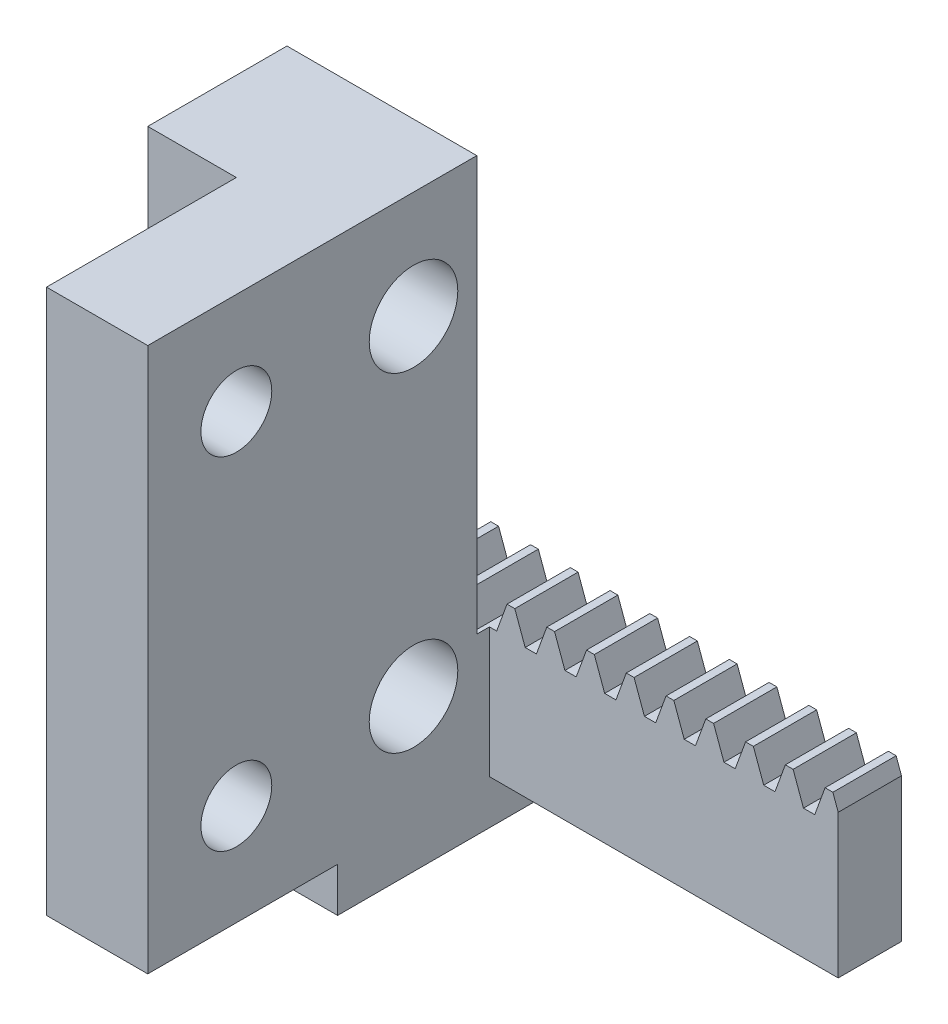
from build123d import *

# Parameters (mm, degrees)
BLANKSKE_W                 = 40
BLANKSKE_H                 = 12.5
BLANK_DEPTH                = 5
TOOTHCUTSIM_DEPTH          = 43.20485754
TEETHCUTS_COUNT            = 14
TEETHCUTS_PITCH            = 3.14159265
MOVE_FACE1_BY              = 0.44
SKETCH1_W                  = 15
SKETCH1_H                  = 43
BOSS_EXTRUDE1_DEPTH        = 12
F_7_0_7_DIAMETER_HOLE1_D   = 7
SKETCH6_W                  = 2.7
SKETCH6_H                  = 17
BOSS_EXTRUDE2_DEPTH        = 3.5
SKETCH7_W                  = 8
SKETCH7_H                  = 43
BOSS_EXTRUDE3_DEPTH        = 15
F_5_6_5_6_DIAMETER_HOLE1_D = 5.6
MOVE_FACE2_BY              = 3
SKETCH11_W                 = 9.6
SKETCH11_H                 = 14
CUT_EXTRUDE2_DEPTH         = 4.5
SKETCH12_W                 = 9.6
SKETCH12_H                 = 3
BOSS_EXTRUDE4_DEPTH        = 3.5
MOVE_FACE3_BY              = 1


with BuildPart() as part:
    # BlankSke → Blank (new body)
    with BuildSketch(Plane.XY):
        with Locations((20, 6.25)):
            Rectangle(BLANKSKE_W, BLANKSKE_H)
    extrude(amount=-BLANK_DEPTH)

    # TooCutSkeSim → ToothCutSim (cut, through all)
    with BuildSketch(Plane.XY):
        Polygon((0.44443537, 10.25), (-0.44443537, 10.25), (-1.272613241, 12.5254), (1.272613241, 12.5254), align=None)
    toothcutsim = extrude(amount=-TOOTHCUTSIM_DEPTH, mode=Mode.SUBTRACT)

    # TeethCuts: ToothCutSim ×14
    with Locations(*[(i * TEETHCUTS_PITCH, 0, 0) for i in range(1, TEETHCUTS_COUNT)]):
        add(toothcutsim, mode=Mode.SUBTRACT)

    # Move Face1: a face moved inward by 0.44
    extrude(part.faces().sort_by_distance((0, 5.125, -2.5))[0], amount=MOVE_FACE1_BY, dir=(1, 0, 0), mode=Mode.SUBTRACT)

    # Sketch1 → Boss-Extrude1 (add)
    with BuildSketch(Plane(origin=(0, 0, 0), x_dir=(-1, 0, 0), z_dir=(0, 0, -1))):
        with Locations((-4.94, 21.5)):
            Rectangle(SKETCH1_W, SKETCH1_H)
    extrude(amount=-BOSS_EXTRUDE1_DEPTH)

    # Ø7.0 (7) Diameter Hole1 (through all)
    with Locations(Plane.ZY.offset(2.56)):
        with Locations((6, 34.5), (6, 8.5)):
            Hole(F_7_0_7_DIAMETER_HOLE1_D / 2)

    # Sketch6 → Boss-Extrude2 (add)
    with BuildSketch(Plane.XZ):
        with Locations((-1.21, 3.5)):
            Rectangle(SKETCH6_W, SKETCH6_H)
        with Locations((11.09, 3.5)):
            Rectangle(SKETCH6_W, SKETCH6_H)
    extrude(amount=BOSS_EXTRUDE2_DEPTH)

    # Sketch7 → Boss-Extrude3 (add)
    with BuildSketch(Plane.XY.offset(12)):
        with Locations((8.44, 21.5)):
            Rectangle(SKETCH7_W, SKETCH7_H)
    extrude(amount=BOSS_EXTRUDE3_DEPTH)

    # Ø5.6 (5.6) Diameter Hole1 (through all)
    with Locations(Plane(origin=(12.44, 0, 0), x_dir=(0, 0, -1), z_dir=(1, 0, 0))):
        with Locations((-20, 35), (-20, 8)):
            Hole(F_5_6_5_6_DIAMETER_HOLE1_D / 2)

    # Move Face2: a face moved outward by 3.0
    extrude(part.faces().sort_by_distance((0.44, 5.125, -2.5))[0], amount=MOVE_FACE2_BY, dir=(-1, 0, 0))

    # Sketch11 → Cut-Extrude2 (cut)
    with BuildSketch(Plane.XZ):
        with Locations((4.94, 2)):
            Rectangle(SKETCH11_W, SKETCH11_H)
    extrude(amount=-CUT_EXTRUDE2_DEPTH, mode=Mode.SUBTRACT)

    # Sketch12 → Boss-Extrude4 (add)
    with BuildSketch(Plane.XZ):
        with Locations((4.94, 10.5)):
            Rectangle(SKETCH12_W, SKETCH12_H)
    extrude(amount=BOSS_EXTRUDE4_DEPTH)

    # Move Face3: a face moved inward by 1.0
    extrude(part.faces().sort_by_distance((4.903765557, 27.042169716, 0))[0], amount=MOVE_FACE3_BY, dir=(0, 0, 1), mode=Mode.SUBTRACT)


solid = part.part
